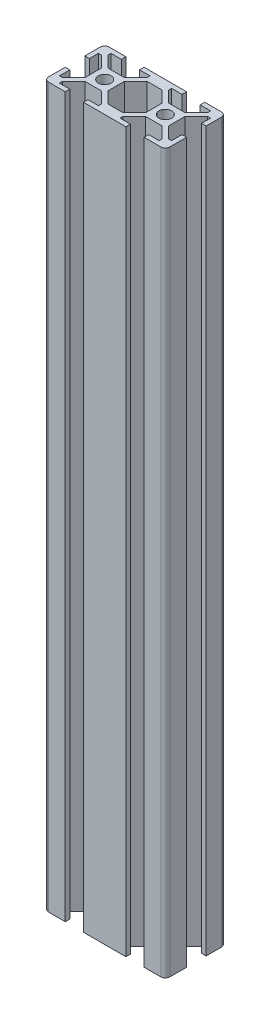
from build123d import *

# Parameters (mm, degrees)
SKETCH1_R           = 2.1
BOSS_EXTRUDE1_DEPTH = 237
FILLET1_R           = 1.5


with BuildPart() as part:
    # Sketch1 → Boss-Extrude1 (new body)
    with BuildSketch(Plane(origin=(0, 0, 0), x_dir=(1, 0, 0), z_dir=(0, 1, 0))):
        Polygon((0, 0), (7, 0), (7, 1.5), (3.560660172, 1.5), (3.560660172, 2.5), (7.260660172, 6.2), (12.739339828, 6.2), (16.439339828, 2.5), (16.439339828, 1.5), (13, 1.5), (13, 0), (27, 0), (27, 1.5), (23.560660172, 1.5), (23.560660172, 2.5), (27.260660172, 6.2), (32.739339828, 6.2), (36.439339828, 2.5), (36.439339828, 1.5), (33, 1.5), (33, 0), (40, 0), (40, 7), (38.5, 7), (38.5, 3.560660172), (37.5, 3.560660172), (33.8, 7.260660172), (33.8, 12.739339828), (37.5, 16.439339828), (38.5, 16.439339828), (38.5, 13.45318801), (40, 13.45318801), (40, 20), (33, 20), (33, 18.5), (36.439339828, 18.5), (36.439339828, 17.5), (32.739339828, 13.8), (27.260660172, 13.8), (23.560660172, 17.5), (23.560660172, 18.5), (27, 18.5), (27, 20), (13, 20), (13, 18.5), (16.439339828, 18.5), (16.439339828, 17.5), (12.739339828, 13.8), (7.260660172, 13.8), (3.560660172, 17.5), (3.560660172, 18.5), (7, 18.5), (7, 20), (0, 20), (0, 13.45318801), (1.5, 13.45318801), (1.5, 16.439339828), (2.5, 16.439339828), (6.2, 12.739339828), (6.2, 7.260660172), (2.5, 3.560660172), (1.5, 3.560660172), (1.5, 7), (0, 7), align=None)
        with Locations(Location((10, 10, 0), (0, 0, 270))):
            Circle(SKETCH1_R, mode=Mode.SUBTRACT)
        with Locations(Location((30, 10, 0), (0, 0, 270))):
            Circle(SKETCH1_R, mode=Mode.SUBTRACT)
        Polygon((17.496963478, 16.458315541), (13.777987766, 12.739339828), (13.777987766, 7.260660172), (17.496963478, 3.541684459), (22.503036522, 3.541684459), (26.222012234, 7.260660172), (26.222012234, 12.739339828), (22.503036522, 16.458315541), align=None, mode=Mode.SUBTRACT)
    extrude(amount=BOSS_EXTRUDE1_DEPTH)

    # Fillet1
    fillet1_edges = [part.edges().sort_by_distance(p)[0] for p in [
        (40, 118.5, -20),
        (40, 118.5, 0),
        (0, 118.5, 0),
        (0, 118.5, -20),
    ]]
    fillet(fillet1_edges, radius=FILLET1_R)


solid = part.part
